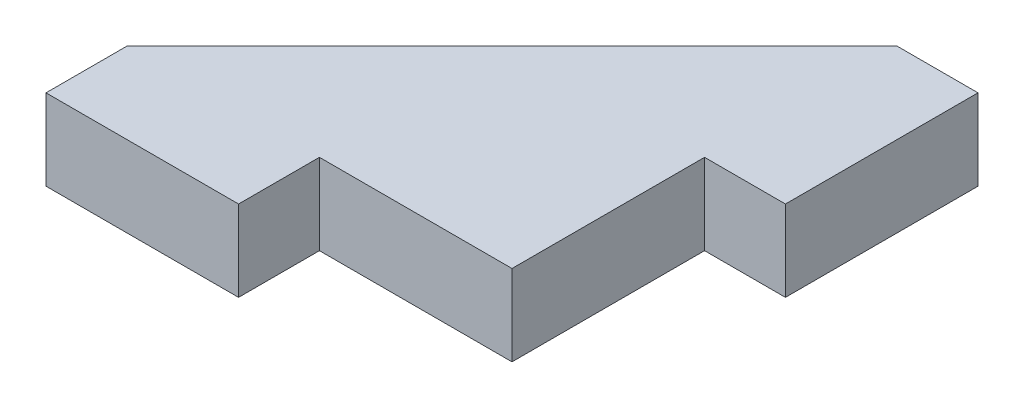
from build123d import *

# Parameters (mm, degrees)
SKETCH1_W           = 12.7
SKETCH1_H           = 5.334
SKETCH1_W_2         = 5.334
SKETCH1_H_2         = 12.7
BOSS_EXTRUDE1_DEPTH = 5.334


with BuildPart() as part:
    # Sketch1 → Boss-Extrude1 (new body)
    with BuildSketch(Plane(origin=(0, 0, 0), x_dir=(1, 0, 0), z_dir=(0, 1, 0))):
        with Locations((-14.711985437, -16.289114223)):
            Rectangle(SKETCH1_W, SKETCH1_H)
        Polygon((4.338014563, 11.777885777), (4.338014563, -13.622114223), (-21.061985437, -13.622114223), align=None)
        with Locations((7.005014563, 5.427885777)):
            Rectangle(SKETCH1_W_2, SKETCH1_H_2)
    extrude(amount=BOSS_EXTRUDE1_DEPTH)


solid = part.part
